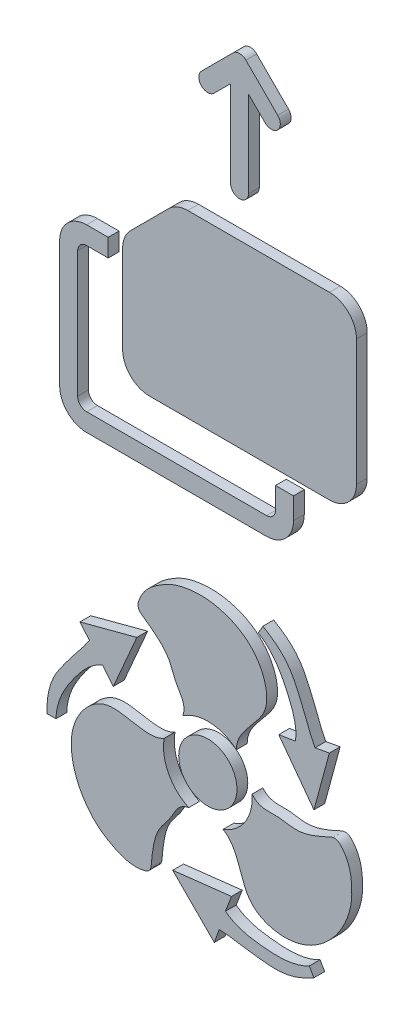
from build123d import *

# Parameters (mm, degrees)
ESQUISSE1_R           = 1.62
BOSS_EXTRU_1_DEPTH    = 0.6
BOSS_EXTRU_1_2_DEPTH  = 0.6
BOSS_EXTRU_1_3_DEPTH  = 0.6
BOSS_EXTRU_1_4_DEPTH  = 0.6
BOSS_EXTRU_1_5_DEPTH  = 0.6
BOSS_EXTRU_1_6_DEPTH  = 0.6
BOSS_EXTRU_1_7_DEPTH  = 0.6
BOSS_EXTRU_1_8_DEPTH  = 0.6
BOSS_EXTRU_1_9_DEPTH  = 0.6
BOSS_EXTRU_1_10_DEPTH = 0.6


with BuildPart() as part:
    # Esquisse1 → Boss.-Extru.1 (new body)
    with BuildSketch(Plane.XY):
        with Locations(Location((73.964561417, -10, 0), (0, 0, 180))):
            Circle(ESQUISSE1_R)
    extrude(amount=BOSS_EXTRU_1_DEPTH)


with BuildPart() as body_2:
    # Esquisse1 → Boss.-Extru.1 2 (new body)
    with BuildSketch(Plane.XY):
        with BuildLine():
            Line((66.851591958, -6.307623742), (67.375435127, -6.925042134))
            add(Edge.make_bspline(
                [(67.375435127, -6.925042134), (67.071631158, -7.423393388), (66.519052829, -8.025592719), (65.881229755, -8.915275939), (65.392931193, -9.604447744), (65.053624701, -10.549482878), (65.018284884, -11.259500196), (65.008863413, -11.636233421)],
                knots=[0, 0, 0, 0, 0.322858089, 0.451825963, 0.608227628, 0.790300876, 1, 1, 1, 1], degree=3))
            Line((65.008863413, -11.636233421), (65.519520145, -11.636233421))
            add(Edge.make_bspline(
                [(65.519520145, -11.636233421), (65.533626408, -11.057078803), (65.837659385, -10.177724816), (66.746586156, -8.841191084), (67.428240115, -8.02508512), (68.115612365, -7.75285457)],
                knots=[0, 0, 0, 0, 0.353975151, 0.561821238, 1, 1, 1, 1], degree=3))
            Line((68.115612365, -7.75285457), (68.709549665, -8.483854324))
            Line((68.709549665, -8.483854324), (70.019257556, -5.467435813))
            Line((70.019257556, -5.467435813), (66.851591958, -6.307623742))
        make_face()
    extrude(amount=BOSS_EXTRU_1_2_DEPTH)


with BuildPart() as body_3:
    # Esquisse1 → Boss.-Extru.1 3 (new body)
    with BuildSketch(Plane.XY):
        with BuildLine():
            Line((74.323354506, -18.006200377), (74.596132935, -17.243829689))
            add(Edge.make_bspline(
                [(74.596132935, -17.243829689), (75.179619765, -17.257756017), (75.977428848, -17.435203222), (77.066828655, -17.542732597), (77.907818227, -17.621025654), (78.895895906, -17.442356128), (79.52845885, -17.117952649), (79.859430128, -16.937745269)],
                knots=[0, 0, 0, 0, 0.322858089, 0.451825963, 0.608227628, 0.790300876, 1, 1, 1, 1], degree=3))
            Line((79.859430128, -16.937745269), (79.604101763, -16.495503567))
            add(Edge.make_bspline(
                [(79.604101763, -16.495503567), (79.095486019, -16.772864494), (78.181926639, -16.949241206), (76.569991088, -16.830354398), (75.522395612, -16.648077735), (74.942950915, -16.188911179)],
                knots=[0, 0, 0, 0, 0.353975151, 0.561821238, 1, 1, 1, 1], degree=3))
            Line((74.942950915, -16.188911179), (75.279046622, -15.309046513))
            Line((75.279046622, -15.309046513), (72.011897618, -15.683015462))
            Line((72.011897618, -15.683015462), (74.323354506, -18.006200377))
        make_face()
    extrude(amount=BOSS_EXTRU_1_3_DEPTH)


with BuildPart() as body_4:
    # Esquisse1 → Boss.-Extru.1 4 (new body)
    with BuildSketch(Plane.XY):
        with BuildLine():
            Line((80.718737786, -5.686175882), (79.922116189, -5.831128177))
            add(Edge.make_bspline(
                [(79.922116189, -5.831128177), (79.642433328, -5.318850595), (79.397202574, -4.539204059), (78.945625841, -3.541991464), (78.592934831, -2.774526602), (77.944163643, -2.008160994), (77.346940518, -1.622547155), (77.025390709, -1.42602131)],
                knots=[0, 0, 0, 0, 0.322858089, 0.451825963, 0.608227628, 0.790300876, 1, 1, 1, 1], degree=3))
            Line((77.025390709, -1.42602131), (76.770062344, -1.868263012))
            add(Edge.make_bspline(
                [(76.770062344, -1.868263012), (77.264571824, -2.170056703), (77.874098227, -2.873033978), (78.577107007, -4.328454518), (78.943048524, -5.326837145), (78.835120971, -6.05823425)],
                knots=[0, 0, 0, 0, 0.353975151, 0.561821238, 1, 1, 1, 1], degree=3))
            Line((78.835120971, -6.05823425), (77.905087965, -6.207099163))
            Line((77.905087965, -6.207099163), (79.862529077, -8.849548724))
            Line((79.862529077, -8.849548724), (80.718737786, -5.686175882))
        make_face()
    extrude(amount=BOSS_EXTRU_1_4_DEPTH)


with BuildPart() as body_5:
    # Esquisse1 → Boss.-Extru.1 5 (new body)
    with BuildSketch(Plane.XY):
        with BuildLine():
            Line((74.311183182, 22.878679656), (75.225396744, 23.792893219))
            Line((75.225396744, 23.792893219), (75.225396744, 19))
            ThreePointArc((75.225396744, 19), (75.725396744, 18.5), (76.225396744, 19))
            Line((76.225396744, 19), (76.225396744, 23.792893219))
            Line((76.225396744, 23.792893219), (77.139610307, 22.878679656))
            ThreePointArc((77.139610307, 22.878679656), (77.846717088, 22.878679656), (77.846717088, 23.585786438))
            Line((77.846717088, 23.585786438), (76.078950135, 25.353553391))
            ThreePointArc((76.078950135, 25.353553391), (75.725396744, 25.5), (75.371843354, 25.353553391))
            Line((75.371843354, 25.353553391), (73.604076401, 23.585786438))
            ThreePointArc((73.604076401, 23.585786438), (73.604076401, 22.878679656), (74.311183182, 22.878679656))
        make_face()
    extrude(amount=BOSS_EXTRU_1_5_DEPTH)


with BuildPart() as body_6:
    # Esquisse1 → Boss.-Extru.1 6 (new body)
    with BuildSketch(Plane.XY):
        with BuildLine():
            Line((70.725396744, 6.5), (80.725396744, 6.5))
            ThreePointArc((80.725396744, 6.5), (81.786056916, 6.939339828), (82.225396744, 8))
            Line((82.225396744, 8), (82.225396744, 15))
            ThreePointArc((82.225396744, 15), (81.786056916, 16.060660172), (80.725396744, 16.5))
            Line((80.725396744, 16.5), (72.846717088, 16.5))
            ThreePointArc((72.846717088, 16.5), (72.272691939, 16.385819299), (71.786056916, 16.060660172))
            Line((71.786056916, 16.060660172), (69.664736573, 13.939339828))
            ThreePointArc((69.664736573, 13.939339828), (69.339577446, 13.452704805), (69.225396744, 12.878679656))
            Line((69.225396744, 12.878679656), (69.225396744, 8))
            ThreePointArc((69.225396744, 8), (69.664736573, 6.939339828), (70.725396744, 6.5))
        make_face()
    extrude(amount=BOSS_EXTRU_1_6_DEPTH)


with BuildPart() as body_7:
    # Esquisse1 → Boss.-Extru.1 7 (new body)
    with BuildSketch(Plane.XY):
        with BuildLine():
            Line((66.725396744, 4.5), (66.725396744, 11.5))
            ThreePointArc((66.725396744, 11.5), (66.871843354, 11.853553391), (67.225396744, 12))
            Line((67.225396744, 12), (68.425396744, 12))
            Line((68.425396744, 12), (68.425396744, 13))
            Line((68.425396744, 13), (67.225396744, 13))
            ThreePointArc((67.225396744, 13), (66.164736573, 12.560660172), (65.725396744, 11.5))
            Line((65.725396744, 11.5), (65.725396744, 4.5))
            ThreePointArc((65.725396744, 4.5), (66.164736573, 3.439339828), (67.225396744, 3))
            Line((67.225396744, 3), (77.225396744, 3))
            ThreePointArc((77.225396744, 3), (78.286056916, 3.439339828), (78.725396744, 4.5))
            Line((78.725396744, 4.5), (78.725396744, 5.7))
            Line((78.725396744, 5.7), (77.725396744, 5.7))
            Line((77.725396744, 5.7), (77.725396744, 4.5))
            ThreePointArc((77.725396744, 4.5), (77.578950135, 4.146446609), (77.225396744, 4))
            Line((77.225396744, 4), (67.225396744, 4))
            ThreePointArc((67.225396744, 4), (66.871843354, 4.146446609), (66.725396744, 4.5))
        make_face()
    extrude(amount=BOSS_EXTRU_1_7_DEPTH)


with BuildPart() as body_8:
    # Esquisse1 → Boss.-Extru.1 8 (new body)
    with BuildSketch(Plane.XY):
        with BuildLine():
            ThreePointArc((71.535753886, -9.569287537), (71.770394602, -11.127054229), (72.899955596, -12.225136781))
            add(Edge.make_bspline(
                [(71.535753886, -9.569287537), (70.585840668, -10.132331882), (68.955654744, -9.082168097), (67.352200801, -10.023756827), (66.698844179, -10.855603196), (66.350776009, -11.908414111), (66.367861724, -12.981673121), (66.67197203, -14.103635192), (67.248491555, -15.045526926), (67.926177962, -15.747593471), (68.591521269, -16.146009975), (69.203488253, -16.440629284), (69.808652285, -16.560639208), (70.287976102, -16.538697367), (70.660267086, -16.430002078), (70.825370363, -16.157240214), (70.820157615, -15.798811375), (70.901813919, -15.299584036), (70.994621423, -14.64848489), (71.282964525, -13.949355119), (72.034251166, -13.18566963), (72.234044366, -12.340652079), (72.899955596, -12.225136781)],
                knots=[0, 0, 0, 0, 0.177515374, 0.224651833, 0.289488625, 0.345336008, 0.400887181, 0.46102568, 0.531695868, 0.577425535, 0.617678532, 0.656656085, 0.687063506, 0.716130115, 0.73507333, 0.745883758, 0.765115099, 0.79185348, 0.828117498, 0.871557477, 0.911340093, 1, 1, 1, 1], degree=3))
        make_face()
    extrude(amount=BOSS_EXTRU_1_8_DEPTH)


with BuildPart() as body_9:
    # Esquisse1 → Boss.-Extru.1 9 (new body)
    with BuildSketch(Plane.XY):
        with BuildLine():
            ThreePointArc((75.551973118, -8.111947209), (74.085587231, -7.536268683), (72.569839348, -7.965455924))
            add(Edge.make_bspline(
                [(75.551973118, -8.111947209), (75.53931902, -7.007776059), (77.263880498, -6.121075527), (77.250167709, -4.261649314), (76.856445932, -3.279902697), (76.11871902, -2.452061363), (75.180706595, -1.930228521), (74.057003787, -1.632614736), (72.953041855, -1.660949422), (72.006191188, -1.896809795), (71.32848072, -2.273805749), (70.767349422, -2.656475049), (70.360835764, -3.120557512), (70.140176048, -3.546635034), (70.048163437, -3.923396129), (70.201830501, -4.202760693), (70.514845355, -4.37746074), (70.906360762, -4.697790843), (71.42382541, -5.103714073), (71.885118002, -5.702991409), (72.170845715, -6.735467471), (72.80275578, -7.331002233), (72.569839348, -7.965455924)],
                knots=[0, 0, 0, 0, 0.177515374, 0.224651833, 0.289488625, 0.345336008, 0.400887181, 0.46102568, 0.531695868, 0.577425535, 0.617678532, 0.656656085, 0.687063506, 0.716130115, 0.73507333, 0.745883758, 0.765115099, 0.79185348, 0.828117498, 0.871557477, 0.911340093, 1, 1, 1, 1], degree=3))
        make_face()
    extrude(amount=BOSS_EXTRU_1_9_DEPTH)


with BuildPart() as body_10:
    # Esquisse1 → Boss.-Extru.1 10 (new body)
    with BuildSketch(Plane.XY):
        with BuildLine():
            ThreePointArc((74.805957248, -12.318765255), (76.037702418, -11.336677088), (76.423889307, -9.809407295))
            add(Edge.make_bspline(
                [(74.805957248, -12.318765255), (75.768524563, -12.85989206), (75.67414901, -14.796756375), (77.291315741, -15.714593859), (78.338394139, -15.864494106), (79.424189222, -15.639524526), (80.345115932, -15.088098358), (81.164708434, -14.263750073), (81.692150842, -13.293523651), (81.961315101, -12.355596734), (81.973682261, -11.580184276), (81.922846575, -10.902895667), (81.724196202, -10.318803281), (81.465532102, -9.914667599), (81.185253728, -9.646601793), (80.866483387, -9.639999093), (80.558681281, -9.823727885), (80.085509571, -10.002625121), (79.475237417, -10.247801037), (78.725601724, -10.347653472), (77.68858737, -10.0788629), (76.856884104, -10.328345688), (76.423889307, -9.809407295)],
                knots=[0, 0, 0, 0, 0.177515374, 0.224651833, 0.289488625, 0.345336008, 0.400887181, 0.46102568, 0.531695868, 0.577425535, 0.617678532, 0.656656085, 0.687063506, 0.716130115, 0.73507333, 0.745883758, 0.765115099, 0.79185348, 0.828117498, 0.871557477, 0.911340093, 1, 1, 1, 1], degree=3))
        make_face()
    extrude(amount=BOSS_EXTRU_1_10_DEPTH)


solid = Compound([part.part, body_2.part, body_3.part, body_4.part, body_5.part, body_6.part, body_7.part, body_8.part, body_9.part, body_10.part])
